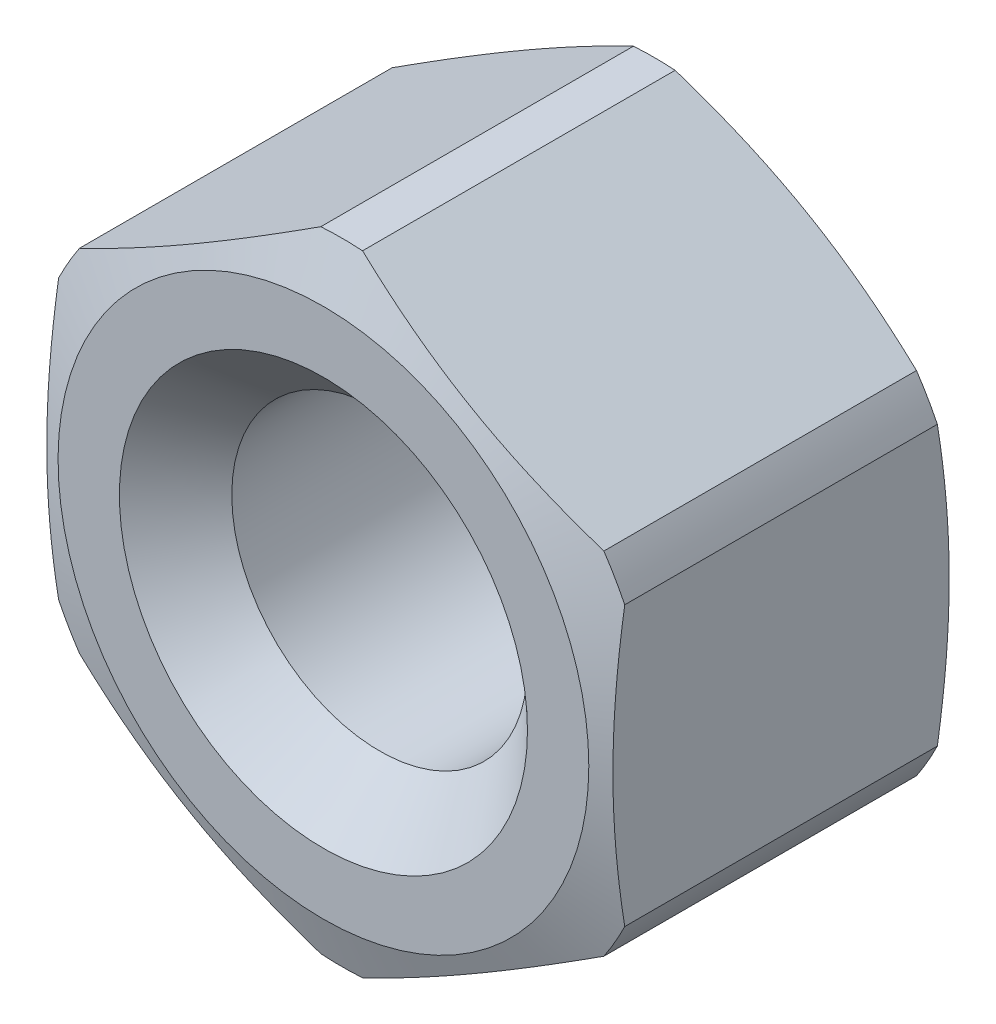
from build123d import *

# Parameters (mm, degrees)
SKETCH_2_OUTSIDE_W  = 36.874
SKETCH_2_OUTSIDE_H  = 36.874
CUT_EXTRUDE_1_DEPTH = 25.017103281


with BuildPart() as part:
    # Эскиз1 → Повернуть1 (revolve)
    with BuildSketch(Plane(origin=(0, 0, 0), x_dir=(0, 0, -1), z_dir=(1, 0, 0)), mode=Mode.PRIVATE) as revolve_1_sk:
        Polygon((-5.017949192, 6.267949192), (5.017949192, 6.267949192), (7.4, 8.65), (7.4, 11.25), (6.626563252, 13.375), (-6.626563252, 13.375), (-7.4, 11.25), (-7.4, 8.65), align=None)
    revolve(revolve_1_sk.sketch.rotate(Axis((0, 0, 152.740188543), (0, 0, -1)), 90), axis=Axis((0, 0, 152.740188543), (0, 0, -1)))

    # Эскиз2 outside → Вырез-Вытянуть1 (cut, through all)
    with BuildSketch(Plane.XY.offset(7.4)):
        Rectangle(SKETCH_2_OUTSIDE_W, SKETCH_2_OUTSIDE_H)
        Polygon((0, -13.856406461), (12, -6.92820323), (12, 6.92820323), (0, 13.856406461), (-12, 6.92820323), (-12, -6.92820323), align=None, mode=Mode.SUBTRACT)
    extrude(amount=-CUT_EXTRUDE_1_DEPTH, mode=Mode.SUBTRACT)


solid = part.part
